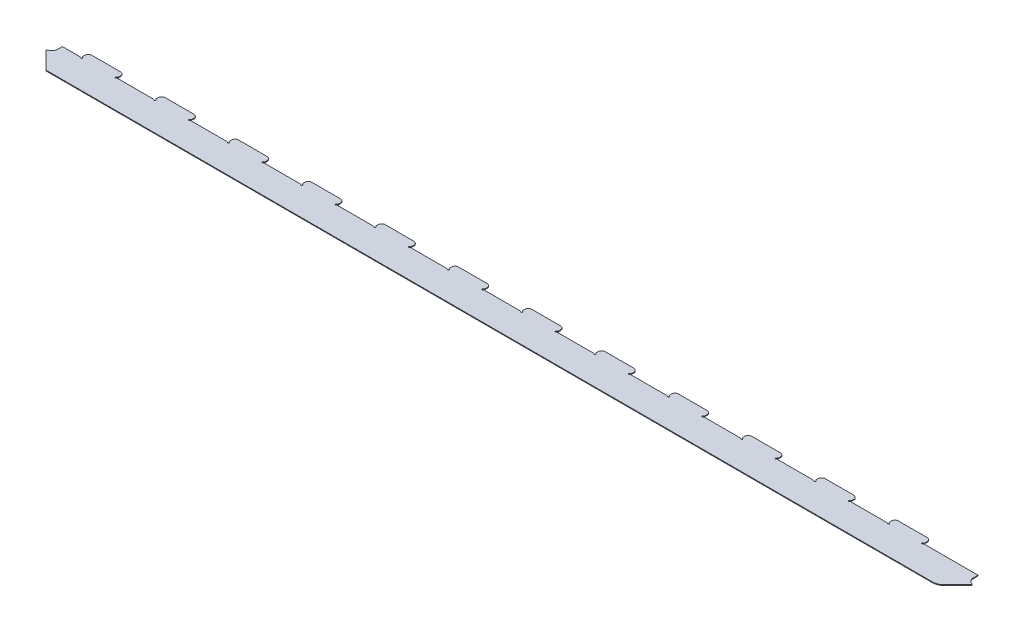
from build123d import *

# Parameters (mm, degrees)
BOSS_EXTRUDE1_DEPTH   = 0.2032
LPATTERN1_COUNT       = 12
LPATTERN1_PITCH       = 20.5
SKETCH2_W             = 10
SKETCH2_H             = 8
BOSS_EXTRUDE3_DEPTH   = 0.2032
BOSS_EXTRUDE4_DEPTH   = 0.2032
BOSS_EXTRUDE4_2_DEPTH = 0.2032
CUT_EXTRUDE2_DEPTH    = 131.058718581
CUT_EXTRUDE3_START    = 8
SKETCH4_W             = 258.757559648
SKETCH4_H             = 0.2032
CUT_EXTRUDE3_DEPTH    = 4


with BuildPart() as part:
    # Sketch1 → Boss-Extrude1 (new body)
    with BuildSketch(Plane(origin=(0, 0, 0), x_dir=(1, 0, 0), z_dir=(0, 1, 0))):
        with BuildLine():
            Line((-123.531854249, -9.171572875), (-121.289213562, -11.414213562))
            ThreePointArc((-121.289213562, -11.414213562), (-120.640366865, -11.847759065), (-119.875, -12))
            Line((-119.875, -12), (-119.375, -12))
            ThreePointArc((-119.375, -12), (-118.667893219, -11.707106781), (-118.375, -11))
            Line((-118.375, -11), (-118.375, -8.5))
            ThreePointArc((-118.375, -8.5), (-118.228553391, -8.146446609), (-117.875, -8))
            Line((-117.875, -8), (-117.875, 2))
            Line((-117.875, 2), (-121.875, 2))
            ThreePointArc((-121.875, 2), (-122.582106781, 1.707106781), (-122.875, 1))
            Line((-122.875, 1), (-122.875, 0.565685425))
            ThreePointArc((-122.875, 0.565685425), (-122.801598632, 0.334745317), (-122.608333333, 0.188561808))
            ThreePointArc((-122.608333333, 0.188561808), (-122.508862264, -0.111347442), (-122.824071199, -0.133333333))
            ThreePointArc((-122.824071199, -0.133333333), (-122.958914279, -0.034851628), (-123.122213595, 0))
            Line((-123.122213595, 0), (-128.125, 0))
            Line((-128.125, 0), (-128.125, -8))
            Line((-128.125, -8), (-126.360281374, -8))
            ThreePointArc((-126.360281374, -8), (-124.829547645, -8.30448187), (-123.531854249, -9.171572875))
        make_face()
    boss_extrude1 = extrude(amount=BOSS_EXTRUDE1_DEPTH)

    # Mirror1: Boss-Extrude1 across plane
    add(boss_extrude1.mirror(Plane(origin=(-117.875, 0, 0), x_dir=(0, 0, 1), z_dir=(1, 0, 0))))


with BuildPart() as lpattern1_1:
    # LPattern1: pattern copy
    add(part.part.moved(Location(Vector(1, 0, 0) * (1 * LPATTERN1_PITCH))))


with BuildPart() as lpattern1_2:
    # LPattern1: pattern copy
    add(part.part.moved(Location(Vector(1, 0, 0) * (2 * LPATTERN1_PITCH))))


with BuildPart() as lpattern1_3:
    # LPattern1: pattern copy
    add(part.part.moved(Location(Vector(1, 0, 0) * (3 * LPATTERN1_PITCH))))


with BuildPart() as lpattern1_4:
    # LPattern1: pattern copy
    add(part.part.moved(Location(Vector(1, 0, 0) * (4 * LPATTERN1_PITCH))))


with BuildPart() as lpattern1_5:
    # LPattern1: pattern copy
    add(part.part.moved(Location(Vector(1, 0, 0) * (5 * LPATTERN1_PITCH))))


with BuildPart() as lpattern1_6:
    # LPattern1: pattern copy
    add(part.part.moved(Location(Vector(1, 0, 0) * (6 * LPATTERN1_PITCH))))


with BuildPart() as lpattern1_7:
    # LPattern1: pattern copy
    add(part.part.moved(Location(Vector(1, 0, 0) * (7 * LPATTERN1_PITCH))))


with BuildPart() as lpattern1_8:
    # LPattern1: pattern copy
    add(part.part.moved(Location(Vector(1, 0, 0) * (8 * LPATTERN1_PITCH))))


with BuildPart() as lpattern1_9:
    # LPattern1: pattern copy
    add(part.part.moved(Location(Vector(1, 0, 0) * (9 * LPATTERN1_PITCH))))


with BuildPart() as lpattern1_10:
    # LPattern1: pattern copy
    add(part.part.moved(Location(Vector(1, 0, 0) * (10 * LPATTERN1_PITCH))))


with BuildPart() as lpattern1_11:
    # LPattern1: pattern copy
    add(part.part.moved(Location(Vector(1, 0, 0) * (11 * LPATTERN1_PITCH))))


with BuildPart() as body_13:
    # Sketch2 → Boss-Extrude3 (new body)
    with BuildSketch(Plane(origin=(0, 0, 0), x_dir=(1, 0, 0), z_dir=(0, 1, 0))):
        with Locations((122.875, -4)):
            Rectangle(SKETCH2_W, SKETCH2_H)
    extrude(amount=BOSS_EXTRUDE3_DEPTH)


with BuildPart() as body_14:
    # Sketch3<3> → Boss-Extrude4 (new body)
    with BuildSketch(Plane(origin=(0, 0, 0), x_dir=(1, 0, 0), z_dir=(0, 1, 0))):
        with BuildLine():
            ThreePointArc((-129.358195327, -2.92434952), (-129.497316347, -3.066370328), (-129.445201181, -3.258225944))
            Line((-129.445201181, -3.258225944), (-128.125, -4.578427125))
            Line((-128.125, -4.578427125), (-128.125, -1.29413))
            ThreePointArc((-128.125, -1.29413), (-128.4680268, -2.316185086), (-129.358195327, -2.92434952))
        make_face()
    extrude(amount=BOSS_EXTRUDE4_DEPTH)


with BuildPart() as body_15:
    # Sketch3<3> → Boss-Extrude4 2 (new body)
    with BuildSketch(Plane(origin=(0, 0, 0), x_dir=(1, 0, 0), z_dir=(0, 1, 0))):
        with BuildLine():
            Line((127.875, -4.578427125), (129.195201181, -3.258225944))
            ThreePointArc((129.195201181, -3.258225944), (129.247316347, -3.066370328), (129.108195327, -2.92434952))
            ThreePointArc((129.108195327, -2.92434952), (128.2180268, -2.316185086), (127.875, -1.29413))
            Line((127.875, -1.29413), (127.875, -4.578427125))
        make_face()
    extrude(amount=BOSS_EXTRUDE4_2_DEPTH)


with BuildPart() as cut_extrude2_tool:
    # Sketch3 → Cut-Extrude2 (new, through all)
    with BuildSketch(Plane(origin=(0, 0, 0), x_dir=(1, 0, 0), z_dir=(0, 1, 0))):
        with BuildLine():
            Line((-123.531854249, -9.171572875), (-128.125, -4.578427125))
            Line((-128.125, -4.578427125), (-128.125, -8))
            Line((-128.125, -8), (-126.360281374, -8))
            ThreePointArc((-126.360281374, -8), (-124.829547645, -8.30448187), (-123.531854249, -9.171572875))
        make_face()
        with BuildLine():
            Line((127.875, -8), (127.875, -4.578427125))
            Line((127.875, -4.578427125), (125.332106781, -7.121320344))
            ThreePointArc((125.332106781, -7.121320344), (124.358836735, -7.771638598), (123.210786438, -8))
            Line((123.210786438, -8), (127.875, -8))
        make_face()
    extrude(amount=CUT_EXTRUDE2_DEPTH)


with BuildPart() as part_1:
    add(part.part)

    # Cut-Extrude2: cut by cut_extrude2_tool
    add(cut_extrude2_tool.part, mode=Mode.SUBTRACT)


with BuildPart() as body_13_1:
    add(body_13.part)

    # Cut-Extrude2: cut by cut_extrude2_tool
    add(cut_extrude2_tool.part, mode=Mode.SUBTRACT)


with BuildPart() as part_2:
    add(part_1.part)

    # Combine1: union LPattern1_11, LPattern1_10, LPattern1_9, LPattern1_8, LPattern1_7, LPattern1_6, LPattern1_5, LPattern1_4, LPattern1_3, LPattern1_2, LPattern1_1, body 13, body 14, body 15
    add(lpattern1_11.part)
    add(lpattern1_10.part)
    add(lpattern1_9.part)
    add(lpattern1_8.part)
    add(lpattern1_7.part)
    add(lpattern1_6.part)
    add(lpattern1_5.part)
    add(lpattern1_4.part)
    add(lpattern1_3.part)
    add(lpattern1_2.part)
    add(lpattern1_1.part)
    add(body_13_1.part)
    add(body_14.part)
    add(body_15.part)

    # Sketch4 → Cut-Extrude3 (cut)
    with BuildSketch(Plane.XY.offset(CUT_EXTRUDE3_START)):
        with Locations((-0.125, 0.1016)):
            Rectangle(SKETCH4_W, SKETCH4_H)
    extrude(amount=CUT_EXTRUDE3_DEPTH, mode=Mode.SUBTRACT)


solid = part_2.part
